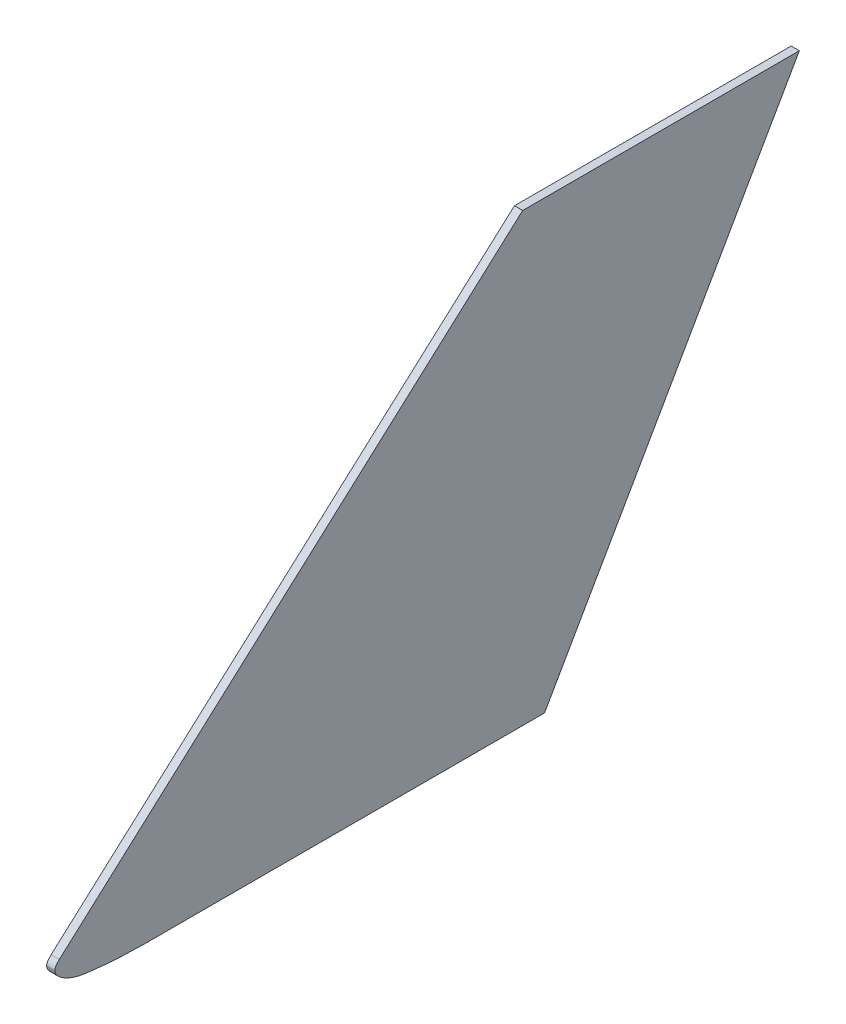
from build123d import *

# Parameters (mm, degrees)
BOSS_EXTRUDE1_DEPTH = 2.667
CUT_EXTRUDE1_DEPTH  = 290.953060218


with BuildPart() as part:
    # Sketch1 → Boss-Extrude1 (new body)
    with BuildSketch(Plane(origin=(0, 0, 0), x_dir=(0, 0, -1), z_dir=(1, 0, 0))):
        Polygon((0, 0), (168.275, 0), (251.079, 145), (161.163, 145), align=None)
    extrude(amount=BOSS_EXTRUDE1_DEPTH)

    # Sketch2 → Cut-Extrude1 (cut, through all)
    with BuildSketch(Plane.ZY):
        with BuildLine():
            Line((-38.268496776, -3.7413e-05), (1.603827089, -0.136652983))
            Line((1.603827089, -0.136652983), (-7.656991971, 9.482815094))
            Line((-7.656991971, 9.482815094), (-10.613049229, 9.482815094))
            add(Edge.make_bspline(
                [(-9.096096952, 6.965105301), (-9.056659473, 7.842017541), (-9.649957621, 8.686611456), (-10.613049229, 9.482815094)],
                knots=[0.095003114, 0.095003114, 0.095003114, 0.095003114, 0.122643686, 0.122643686, 0.122643686, 0.122643686], degree=3))
            add(Edge.make_bspline(
                [(-20.479171235, 1.104059742), (-19.78420669, 1.190866413), (-14.294371688, 1.692059126), (-9.186269713, 4.960068489), (-9.096096952, 6.965105301)],
                knots=[0, 0, 0, 0, 0.031803671, 0.095003114, 0.095003114, 0.095003114, 0.095003114], degree=3))
            add(Edge.make_bspline(
                [(-38.268496776, -3.7413e-05), (-29.333639406, -0.001953509), (-20.479171235, 1.104059742)],
                knots=[0, 0, 0, 1, 1, 1], degree=2))
        make_face()
    extrude(amount=-CUT_EXTRUDE1_DEPTH, mode=Mode.SUBTRACT)


solid = part.part
